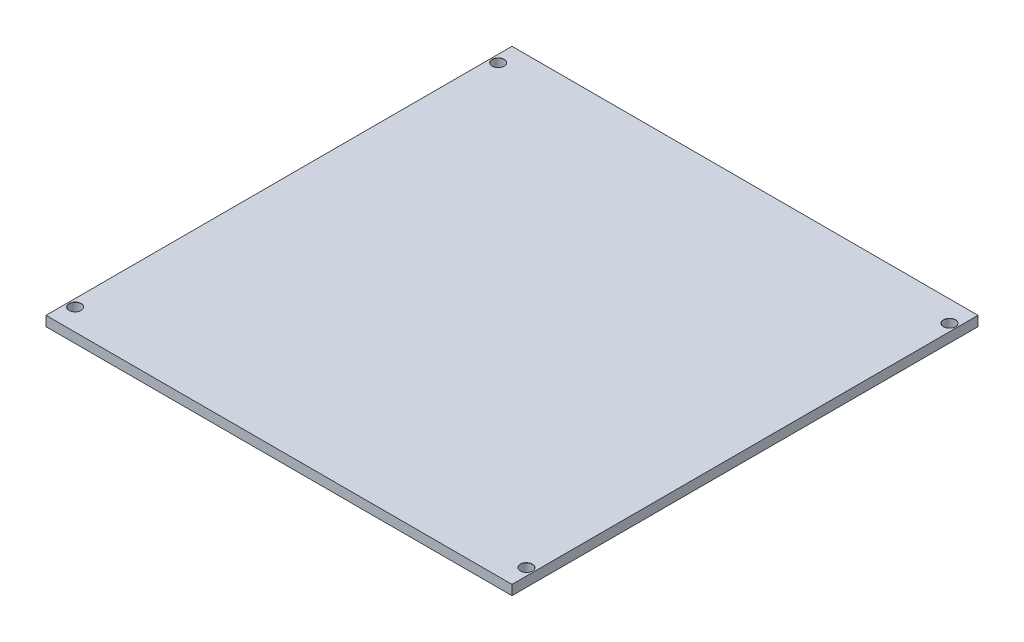
from build123d import *

# Parameters (mm, degrees)
SKETCH2_W                      = 94.75
SKETCH2_H                      = 94.75
BOSS_EXTRUDE1_DEPTH            = 2
M2_CLEARANCE_HOLE1_D           = 2.4
M2_CLEARANCE_HOLE1_CSINK_D     = 2.45
M2_CLEARANCE_HOLE1_CSINK_ANGLE = 90


with BuildPart() as part:
    # Sketch2 → Boss-Extrude1 (new body)
    with BuildSketch(Plane(origin=(0, 0, 0), x_dir=(1, 0, 0), z_dir=(0, 1, 0))):
        Rectangle(SKETCH2_W, SKETCH2_H)
    extrude(amount=BOSS_EXTRUDE1_DEPTH)

    # M2 Clearance Hole1 (through all)
    with Locations(Plane(origin=(0, 2, 0), x_dir=(1, 0, 0), z_dir=(0, 1, 0))):
        with Locations((45.875, 43.083888437), (-45.875, 43.071998249), (-45.875, -42.94115636), (45.875, -42.952928811)):
            CounterSinkHole(M2_CLEARANCE_HOLE1_D / 2, M2_CLEARANCE_HOLE1_CSINK_D / 2, counter_sink_angle=M2_CLEARANCE_HOLE1_CSINK_ANGLE)


solid = part.part
